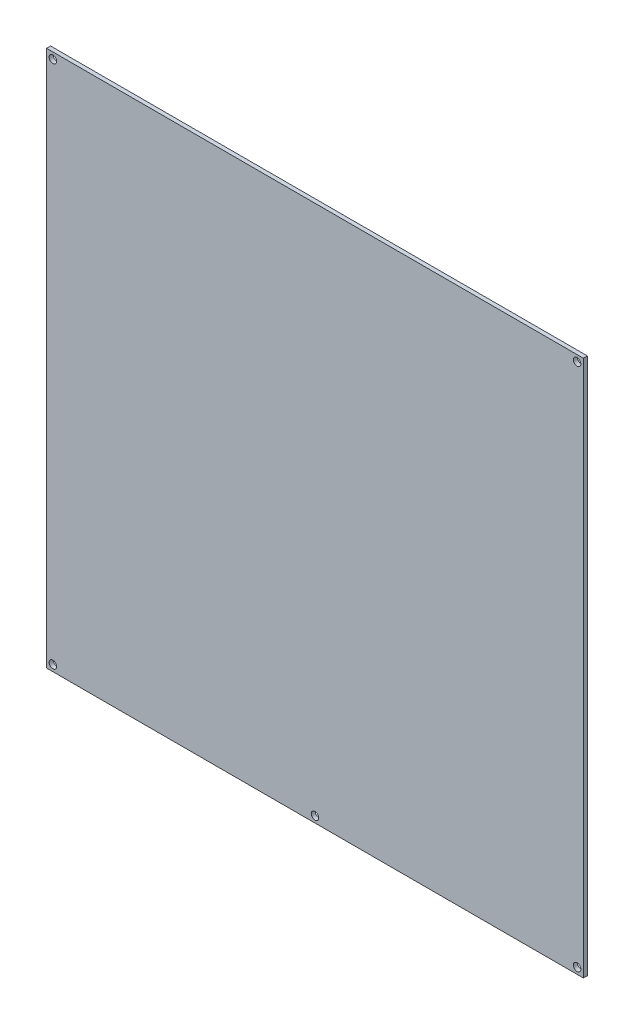
from build123d import *

# Parameters (mm, degrees)
SKETCH1_W           = 214
SKETCH1_H           = 214
SKETCH1_R           = 1.5
BOSS_EXTRUDE1_DEPTH = 1.6


with BuildPart() as part:
    # Sketch1 → Boss-Extrude1 (new body)
    with BuildSketch(Plane.XY):
        Rectangle(SKETCH1_W, SKETCH1_H)
        with Locations((-104.5, 104.5)):
            Circle(SKETCH1_R, mode=Mode.SUBTRACT)
        with Locations((104.5, 104.5)):
            Circle(SKETCH1_R, mode=Mode.SUBTRACT)
        with Locations((0, -104.5)):
            Circle(SKETCH1_R, mode=Mode.SUBTRACT)
        with Locations(Location((104.5, -104.5, 0), (0, 0, 180))):
            Circle(SKETCH1_R, mode=Mode.SUBTRACT)
        with Locations(Location((-104.5, -104.5, 0), (0, 0, 180))):
            Circle(SKETCH1_R, mode=Mode.SUBTRACT)
    extrude(amount=BOSS_EXTRUDE1_DEPTH)


solid = part.part
